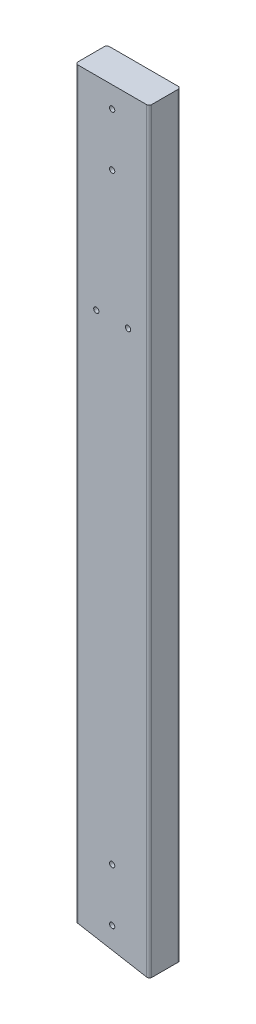
from build123d import *

# Parameters (mm, degrees)
SKETCH1_W                   = 88.9
SKETCH1_H                   = 38.1
BOSS_EXTRUDE1_DEPTH         = 909.6375
CUT_EXTRUDE1_DEPTH          = 1257.6367532
F_1_4_0_25_DIAMETER_HOLE2_D = 6.35
FILLET1_R                   = 3.175


with BuildPart() as part:
    # Sketch1 → Boss-Extrude1 (new body)
    with BuildSketch(Plane(origin=(0, 0, 0), x_dir=(1, 0, 0), z_dir=(0, 1, 0))):
        Rectangle(SKETCH1_W, SKETCH1_H)
    extrude(amount=BOSS_EXTRUDE1_DEPTH)

    # Sketch2 → Cut-Extrude1 (cut)
    with BuildSketch(Plane.XY.offset(19.05)):
        Polygon((44.45, 0), (-44.45, 15.675468585), (-44.45, 0), align=None)
    extrude(amount=-CUT_EXTRUDE1_DEPTH, mode=Mode.SUBTRACT)

    # 1/4 (0.25) Diameter Hole2 (through all)
    with Locations(Plane.XY.offset(19.05)):
        with Locations((0, 33.6295746), (0, 97.1295746), (19.05, 665.2279812), (-19.05, 665.2279812), (0, 820.7375), (0, 884.2375)):
            Hole(F_1_4_0_25_DIAMETER_HOLE2_D / 2)

    # Fillet1
    fillet1_edges = [part.edges().sort_by_distance(p)[0] for p in [
        (-44.45, 462.656484292, -19.05),
        (44.45, 454.81875, -19.05),
        (44.45, 454.81875, 19.05),
        (-44.45, 462.656484292, 19.05),
    ]]
    fillet(fillet1_edges, radius=FILLET1_R)


solid = part.part
